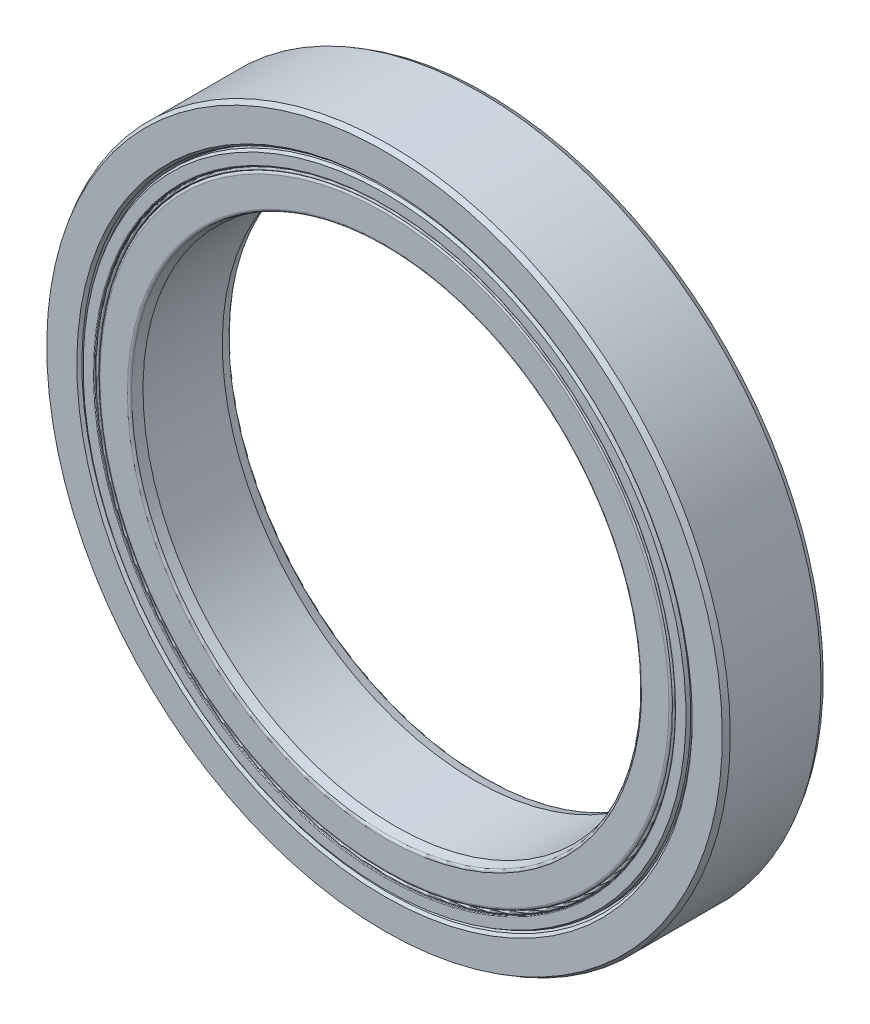
from build123d import *

# Parameters (mm, degrees)
CIRPATTERN1_COUNT = 18


with BuildPart() as part:
    # Sketch3 → Revolve1 (revolve)
    with BuildSketch(Plane(origin=(0, 0, 0), x_dir=(0, 0, -1), z_dir=(1, 0, 0)), mode=Mode.PRIVATE) as revolve1_sk:
        with BuildLine():
            Line((-1.682987285, 12.015), (-1.9, 12.093986169))
            Line((-1.9, 12.093986169), (-2, 12.193986169))
            Line((-2, 12.193986169), (-2, 13.384529946))
            Line((-2, 13.384529946), (-1.8, 13.5))
            Line((-1.8, 13.5), (1.8, 13.5))
            Line((1.8, 13.5), (2, 13.384529946))
            Line((2, 13.384529946), (2, 12.193986169))
            Line((2, 12.193986169), (1.9, 12.093986169))
            Line((1.9, 12.093986169), (1.682987285, 12.015))
            Line((1.682987285, 12.015), (1.272261766, 12.015))
            ThreePointArc((1.272261766, 12.015), (0, 13.005), (-1.272261766, 12.015))
            Line((-1.272261766, 12.015), (-1.682987285, 12.015))
        make_face()
    revolve(revolve1_sk.sketch.rotate(Axis((0, 0, 2), (0, 0, -1)), 180), axis=Axis((0, 0, 2), (0, 0, -1)))


with BuildPart() as body_2:
    # Sketch4 → Revolve2 (revolve)
    with BuildSketch(Plane(origin=(0, 0, 0), x_dir=(0, 0, -1), z_dir=(1, 0, 0)), mode=Mode.PRIVATE) as revolve2_sk:
        with BuildLine():
            Line((-1.572559109, 10), (-1.927103936, 10.095))
            ThreePointArc((-1.927103936, 10.095), (-1.979676045, 10.13012756), (-2, 10.19))
            Line((-2, 10.19), (-2, 11.271648763))
            ThreePointArc((-2, 11.271648763), (-1.97119359, 11.34119359), (-1.901648763, 11.37))
            Line((-1.901648763, 11.37), (-1.272261766, 11.37))
            ThreePointArc((-1.272261766, 11.37), (0, 10.38), (1.272261766, 11.37))
            Line((1.272261766, 11.37), (1.901648763, 11.37))
            ThreePointArc((1.901648763, 11.37), (1.97119359, 11.34119359), (2, 11.271648763))
            Line((2, 11.271648763), (2, 10.19))
            ThreePointArc((2, 10.19), (1.979676045, 10.13012756), (1.927103936, 10.095))
            Line((1.927103936, 10.095), (1.572559109, 10))
            Line((1.572559109, 10), (-1.572559109, 10))
        make_face()
    revolve(revolve2_sk.sketch.rotate(Axis((0, 0, 2), (0, 0, -1)), 180), axis=Axis((0, 0, 2), (0, 0, -1)))


with BuildPart() as body_3:
    # Sketch5 → Revolve3 (revolve)
    with BuildSketch(Plane(origin=(0, 0, 0), x_dir=(0, 0, -1), z_dir=(1, 0, 0))):
        with BuildLine():
            Line((-1.3125, 11.6925), (1.3125, 11.6925))
            ThreePointArc((1.3125, 11.6925), (0, 13.005), (-1.3125, 11.6925))
        make_face()
    revolve(axis=Axis((0, 11.6925, 1.3125), (0, 0, -1)))


with BuildPart() as cirpattern1_1:
    # CirPattern1: pattern copy
    add(body_3.part.rotate(Axis((0, 0, 0), (0, 0, 1)), 1 * 360 / CIRPATTERN1_COUNT))


with BuildPart() as cirpattern1_2:
    # CirPattern1: pattern copy
    add(body_3.part.rotate(Axis((0, 0, 0), (0, 0, 1)), 2 * 360 / CIRPATTERN1_COUNT))


with BuildPart() as cirpattern1_3:
    # CirPattern1: pattern copy
    add(body_3.part.rotate(Axis((0, 0, 0), (0, 0, 1)), 3 * 360 / CIRPATTERN1_COUNT))


with BuildPart() as cirpattern1_4:
    # CirPattern1: pattern copy
    add(body_3.part.rotate(Axis((0, 0, 0), (0, 0, 1)), 4 * 360 / CIRPATTERN1_COUNT))


with BuildPart() as cirpattern1_5:
    # CirPattern1: pattern copy
    add(body_3.part.rotate(Axis((0, 0, 0), (0, 0, 1)), 5 * 360 / CIRPATTERN1_COUNT))


with BuildPart() as cirpattern1_6:
    # CirPattern1: pattern copy
    add(body_3.part.rotate(Axis((0, 0, 0), (0, 0, 1)), 6 * 360 / CIRPATTERN1_COUNT))


with BuildPart() as cirpattern1_7:
    # CirPattern1: pattern copy
    add(body_3.part.rotate(Axis((0, 0, 0), (0, 0, 1)), 7 * 360 / CIRPATTERN1_COUNT))


with BuildPart() as cirpattern1_8:
    # CirPattern1: pattern copy
    add(body_3.part.rotate(Axis((0, 0, 0), (0, 0, 1)), 8 * 360 / CIRPATTERN1_COUNT))


with BuildPart() as cirpattern1_9:
    # CirPattern1: pattern copy
    add(body_3.part.rotate(Axis((0, 0, 0), (0, 0, 1)), 9 * 360 / CIRPATTERN1_COUNT))


with BuildPart() as cirpattern1_10:
    # CirPattern1: pattern copy
    add(body_3.part.rotate(Axis((0, 0, 0), (0, 0, 1)), 10 * 360 / CIRPATTERN1_COUNT))


with BuildPart() as cirpattern1_11:
    # CirPattern1: pattern copy
    add(body_3.part.rotate(Axis((0, 0, 0), (0, 0, 1)), 11 * 360 / CIRPATTERN1_COUNT))


with BuildPart() as cirpattern1_12:
    # CirPattern1: pattern copy
    add(body_3.part.rotate(Axis((0, 0, 0), (0, 0, 1)), 12 * 360 / CIRPATTERN1_COUNT))


with BuildPart() as cirpattern1_13:
    # CirPattern1: pattern copy
    add(body_3.part.rotate(Axis((0, 0, 0), (0, 0, 1)), 13 * 360 / CIRPATTERN1_COUNT))


with BuildPart() as cirpattern1_14:
    # CirPattern1: pattern copy
    add(body_3.part.rotate(Axis((0, 0, 0), (0, 0, 1)), 14 * 360 / CIRPATTERN1_COUNT))


with BuildPart() as cirpattern1_15:
    # CirPattern1: pattern copy
    add(body_3.part.rotate(Axis((0, 0, 0), (0, 0, 1)), 15 * 360 / CIRPATTERN1_COUNT))


with BuildPart() as cirpattern1_16:
    # CirPattern1: pattern copy
    add(body_3.part.rotate(Axis((0, 0, 0), (0, 0, 1)), 16 * 360 / CIRPATTERN1_COUNT))


with BuildPart() as cirpattern1_17:
    # CirPattern1: pattern copy
    add(body_3.part.rotate(Axis((0, 0, 0), (0, 0, 1)), 17 * 360 / CIRPATTERN1_COUNT))


with BuildPart() as body_21:
    # Sketch6 → Revolve4 (revolve)
    with BuildSketch(Plane(origin=(0, 0, 0), x_dir=(0, 0, -1), z_dir=(1, 0, 0)), mode=Mode.PRIVATE) as revolve4_sk:
        with BuildLine():
            Line((-1.878756443, 12.015), (-1.3125, 12.015))
            Line((-1.3125, 12.015), (-1.3125, 11.51))
            Line((-1.3125, 11.51), (-1.972, 11.51))
            ThreePointArc((-1.972, 11.51), (-1.99179899, 11.51820101), (-2, 11.538))
            Line((-2, 11.538), (-2, 11.945))
            Line((-2, 11.945), (-1.878756443, 12.015))
        make_face()
        with BuildLine():
            Line((1.972, 11.51), (1.3125, 11.51))
            Line((1.3125, 11.51), (1.3125, 12.015))
            Line((1.3125, 12.015), (1.878756443, 12.015))
            Line((1.878756443, 12.015), (2, 11.945))
            Line((2, 11.945), (2, 11.538))
            ThreePointArc((2, 11.538), (1.99179899, 11.51820101), (1.972, 11.51))
        make_face()
    revolve(revolve4_sk.sketch.rotate(Axis((0, 0, 2), (0, 0, -1)), 180), axis=Axis((0, 0, 2), (0, 0, -1)))


with BuildPart() as body_22:
    # Sketch7 → Revolve5 (revolve)
    with BuildSketch(Plane(origin=(0, 0, 0), x_dir=(0, 0, -1), z_dir=(1, 0, 0)), mode=Mode.PRIVATE) as revolve5_sk:
        with BuildLine():
            Line((-1.3125, 11.51), (-1.890562103, 11.51))
            Line((-1.890562103, 11.51), (-1.925030375, 11.503922314))
            ThreePointArc((-1.925030375, 11.503922314), (-1.937016396, 11.488301826), (-1.9225, 11.475))
            Line((-1.9225, 11.475), (-1.9475, 11.475))
            ThreePointArc((-1.9475, 11.475), (-2, 11.4225), (-1.9475, 11.37))
            Line((-1.9475, 11.37), (-1.3125, 11.37))
            Line((-1.3125, 11.37), (-1.3125, 11.51))
        make_face()
    revolve(revolve5_sk.sketch.rotate(Axis((0, 0, 2), (0, 0, -1)), 180), axis=Axis((0, 0, 2), (0, 0, -1)))


solid = Compound([part.part, body_2.part, body_3.part, cirpattern1_1.part, cirpattern1_2.part, cirpattern1_3.part, cirpattern1_4.part, cirpattern1_5.part, cirpattern1_6.part, cirpattern1_7.part, cirpattern1_8.part, cirpattern1_9.part, cirpattern1_10.part, cirpattern1_11.part, cirpattern1_12.part, cirpattern1_13.part, cirpattern1_14.part, cirpattern1_15.part, cirpattern1_16.part, cirpattern1_17.part, body_21.part, body_22.part])
